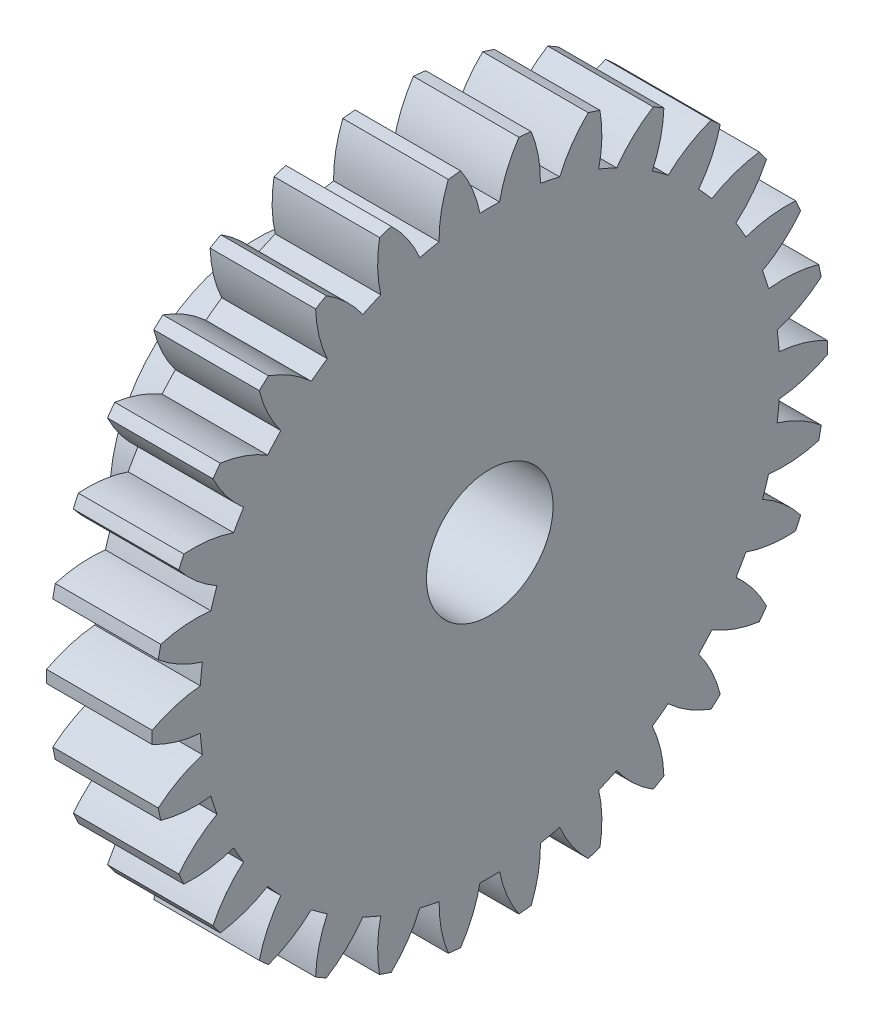
from build123d import *

# Parameters (mm, degrees)
BASPROSKE_W      = 5
BASPROSKE_H      = 16
TOOTHCUT_DEPTH   = 24.173260453
TEETHCUTS_COUNT  = 30
TEETHCUTS_ANGLE  = 348
HUBNEAONESKE_R   = 7
HUBNEARONE_DEPTH = 6.0000508
BORSKE_R         = 3
BORE_DEPTH       = 11.0000508


with BuildPart() as part:
    # BasProSke → Base-Revolve (revolve)
    with BuildSketch(Plane(origin=(0, 0, 0), x_dir=(1, 0, 0), z_dir=(0, 1, 0)), mode=Mode.PRIVATE) as base_revolve_sk:
        with Locations((2.5, 8)):
            Rectangle(BASPROSKE_W, BASPROSKE_H)
    revolve(base_revolve_sk.sketch.rotate(Axis((-10, 0, 0), (1, 0, 0)), 180), axis=Axis((-10, 0, 0), (1, 0, 0)))

    # TooCutSke → ToothCut (cut, through all)
    with BuildSketch(Plane(origin=(0, 0, 0), x_dir=(0, 0, -1), z_dir=(1, 0, 0))):
        with BuildLine():
            ThreePointArc((0.466400716, 13.741086979), (0, 13.749), (-0.466400716, 13.741086979))
            ThreePointArc((-0.466400716, 13.741086979), (-0.819142092, 14.899954875), (-1.3974676, 15.964351834))
            ThreePointArc((-1.3974676, 15.964351834), (0, 16.0254), (1.3974676, 15.964351834))
            ThreePointArc((1.3974676, 15.964351834), (0.819142092, 14.899954875), (0.466400716, 13.741086979))
        make_face()
    toothcut = extrude(amount=TOOTHCUT_DEPTH, mode=Mode.SUBTRACT)

    # TeethCuts: ToothCut ×30 about axis
    teethcuts_axis = Axis((-10, 0, 0), (1, 0, 0))
    for i in range(1, TEETHCUTS_COUNT):
        add(toothcut.rotate(teethcuts_axis, i * TEETHCUTS_ANGLE / (TEETHCUTS_COUNT - 1)), mode=Mode.SUBTRACT)

    # HubNeaOneSke → HubNearOne (add)
    with BuildSketch(Plane.ZY):
        with Locations(Location((0, 0, 0), (0, 0, 180))):
            Circle(HUBNEAONESKE_R)
    extrude(amount=HUBNEARONE_DEPTH)

    # BorSke → Bore (cut, symmetric)
    with BuildSketch(Plane(origin=(0, 0, 0), x_dir=(0, 0, -1), z_dir=(1, 0, 0))):
        with Locations(Location((0, 0, 0), (0, 0, 180))):
            Circle(BORSKE_R)
    extrude(amount=BORE_DEPTH, both=True, mode=Mode.SUBTRACT)


solid = part.part
